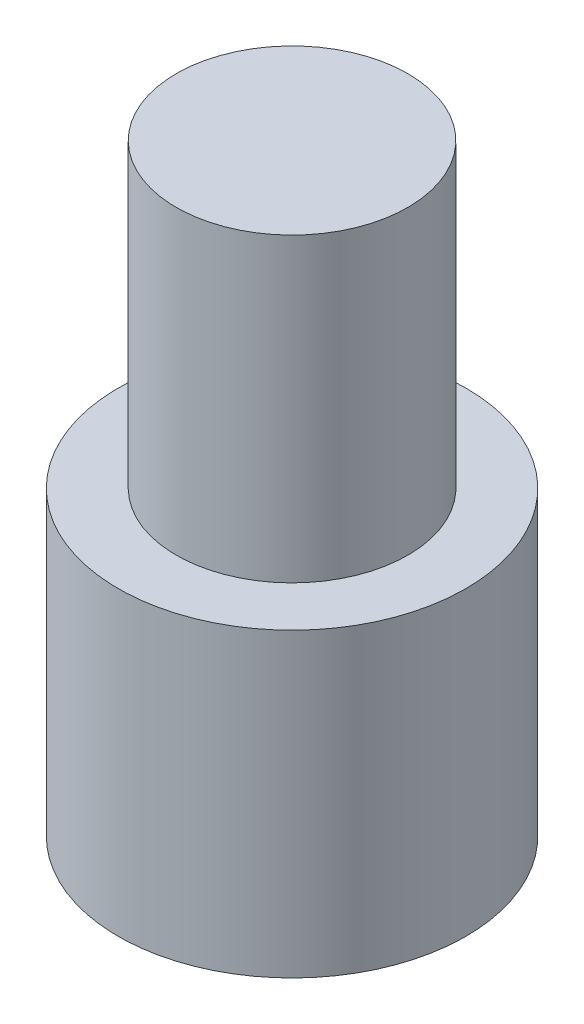
from build123d import *

# Parameters (mm, degrees)
SKETCH1_R           = 7.5
BOSS_EXTRUDE1_DEPTH = 13
SKETCH2_R           = 5
BOSS_EXTRUDE2_DEPTH = 13
SKETCH3_R           = 3
CUT_EXTRUDE1_DEPTH  = 11


with BuildPart() as part:
    # Sketch1 → Boss-Extrude1 (new body)
    with BuildSketch(Plane(origin=(0, 0, 0), x_dir=(1, 0, 0), z_dir=(0, 1, 0))):
        with Locations(Location((-60.215324611, 24.355385361, 0), (0, 0, 90))):
            Circle(SKETCH1_R)
    extrude(amount=BOSS_EXTRUDE1_DEPTH)

    # Sketch2 → Boss-Extrude2 (add)
    with BuildSketch(Plane(origin=(0, 13, 0), x_dir=(1, 0, 0), z_dir=(0, 1, 0))):
        with Locations(Location((-60.215324611, 24.355385361, 0), (0, 0, 90))):
            Circle(SKETCH2_R)
    extrude(amount=BOSS_EXTRUDE2_DEPTH)

    # Sketch3 → Cut-Extrude1 (cut)
    with BuildSketch(Plane.XZ):
        with Locations(Location((-60.215324611, -24.355385361, 0), (0, 0, 270))):
            Circle(SKETCH3_R)
    extrude(amount=-CUT_EXTRUDE1_DEPTH, mode=Mode.SUBTRACT)


solid = part.part
